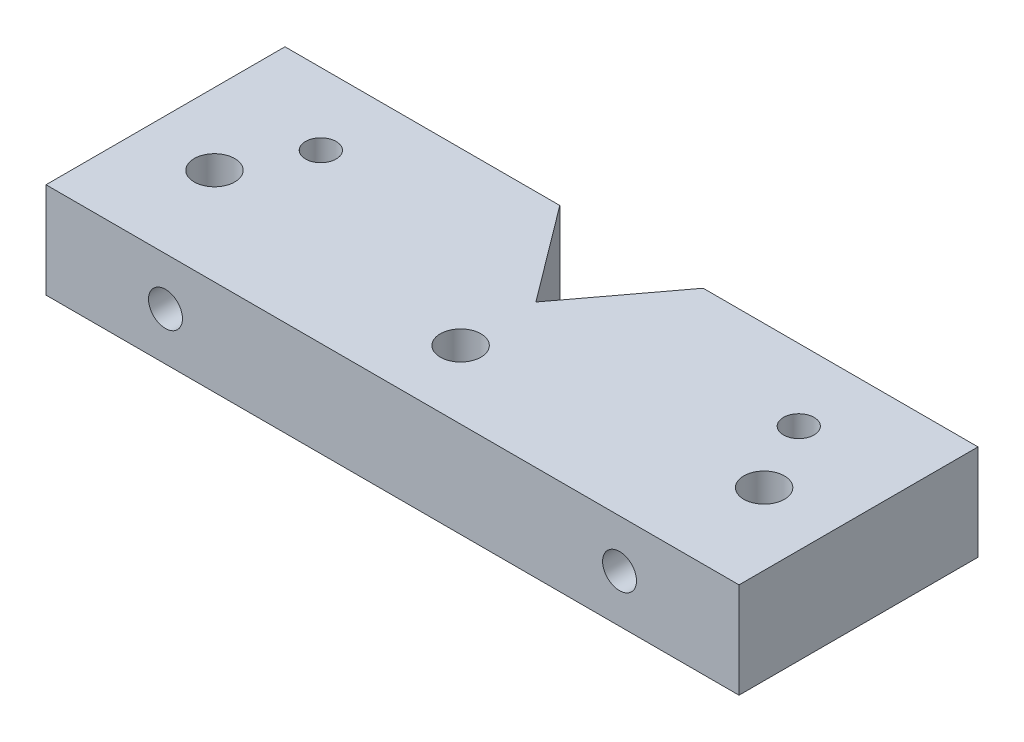
from build123d import *

# Parameters (mm, degrees)
SKETCH1_R           = 4.25
BOSS_EXTRUDE1_DEPTH = 20
SKETCH3_R           = 3.55
CUT_EXTRUDE2_DEPTH  = 10.5
SKETCH2_R           = 3.2
CUT_EXTRUDE3_DEPTH  = 10.5


with BuildPart() as part:
    # Sketch1 → Boss-Extrude1 (new body)
    with BuildSketch(Plane(origin=(0, 0, 0), x_dir=(1, 0, 0), z_dir=(0, 1, 0))):
        Polygon((0, 0), (0, 50), (57.5, 50), (72.5, 30), (87.5, 50), (145, 50), (145, 0), align=None)
        with Locations(Location((15, 20.25, 0), (0, 0, 270))):
            Circle(SKETCH1_R, mode=Mode.SUBTRACT)
        with Locations(Location((72.5, 14.25, 0), (0, 0, 270))):
            Circle(SKETCH1_R, mode=Mode.SUBTRACT)
        with Locations(Location((130, 20.25, 0), (0, 0, 270))):
            Circle(SKETCH1_R, mode=Mode.SUBTRACT)
    extrude(amount=BOSS_EXTRUDE1_DEPTH)

    # Sketch3 → Cut-Extrude2 (cut)
    with BuildSketch(Plane.XY):
        with Locations((25, 10)):
            Circle(SKETCH3_R)
        with Locations((120, 10)):
            Circle(SKETCH3_R)
    extrude(amount=-CUT_EXTRUDE2_DEPTH, mode=Mode.SUBTRACT)

    # Sketch2 → Cut-Extrude3 (cut)
    with BuildSketch(Plane(origin=(0, 20, 0), x_dir=(1, 0, 0), z_dir=(0, 1, 0))):
        with Locations(Location((22.5, 35, 0), (0, 0, 270))):
            Circle(SKETCH2_R)
        with Locations(Location((122.5, 35, 0), (0, 0, 270))):
            Circle(SKETCH2_R)
    extrude(amount=-CUT_EXTRUDE3_DEPTH, mode=Mode.SUBTRACT)


solid = part.part
